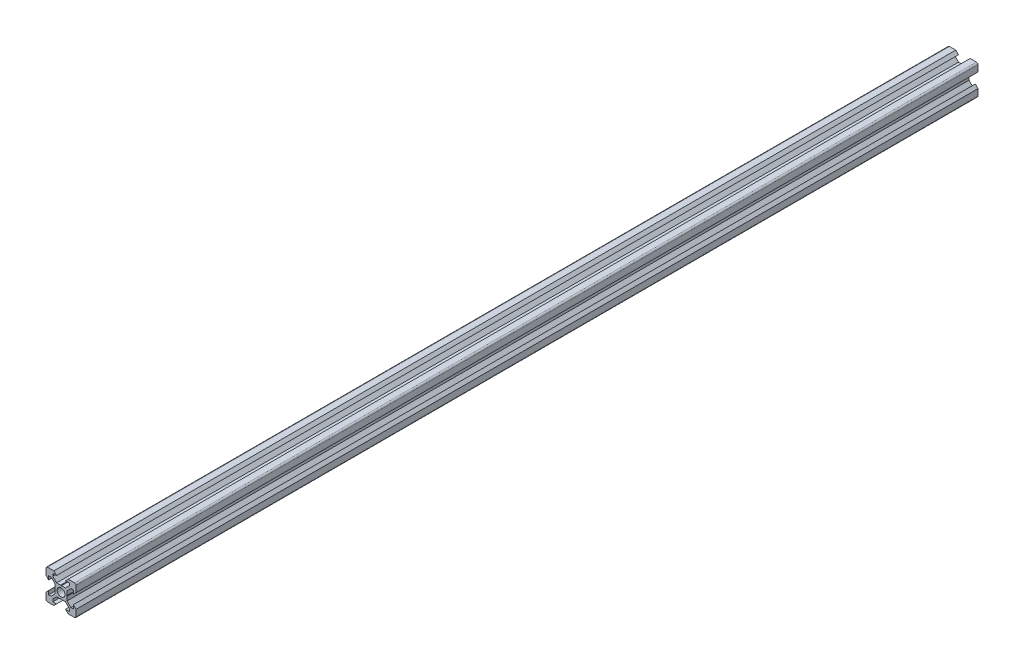
from build123d import *

# Parameters (mm, degrees)
SKETCH1_R           = 2.6
BOSS_EXTRUDE1_DEPTH = 600


with BuildPart() as part:
    # Sketch1 → Boss-Extrude1 (new body)
    with BuildSketch(Plane.XY):
        with BuildLine():
            Line((10.336788111, -8.113366567), (10.336788111, -3.913366567))
            Line((10.336788111, -3.913366567), (8.536788111, -2.113366567))
            Line((8.536788111, -2.113366567), (8.536788111, -4.613366567))
            Line((8.536788111, -4.613366567), (6.897448282, -4.613366567))
            Line((6.897448282, -4.613366567), (4.336788111, -2.052706395))
            Line((4.336788111, -2.052706395), (4.336788111, 0.586633433))
            Line((4.336788111, 0.586633433), (4.036788111, 0.886633433))
            Line((4.036788111, 0.886633433), (4.336788111, 1.186633433))
            Line((4.336788111, 1.186633433), (4.336788111, 3.825973261))
            Line((4.336788111, 3.825973261), (6.897448282, 6.386633433))
            Line((6.897448282, 6.386633433), (8.536788111, 6.386633433))
            Line((8.536788111, 6.386633433), (8.536788111, 3.886633433))
            Line((8.536788111, 3.886633433), (10.336788111, 5.686633433))
            Line((10.336788111, 5.686633433), (10.336788111, 9.886633433))
            ThreePointArc((10.336788111, 9.886633433), (10.043894892, 10.593740214), (9.336788111, 10.886633433))
            Line((9.336788111, 10.886633433), (5.136788111, 10.886633433))
            Line((5.136788111, 10.886633433), (3.336788111, 9.086633433))
            Line((3.336788111, 9.086633433), (5.836788111, 9.086633433))
            Line((5.836788111, 9.086633433), (5.836788111, 7.447293605))
            Line((5.836788111, 7.447293605), (3.276127939, 4.886633433))
            Line((3.276127939, 4.886633433), (0.636788111, 4.886633433))
            Line((0.636788111, 4.886633433), (0.336788111, 4.586633433))
            Line((0.336788111, 4.586633433), (0.036788111, 4.886633433))
            Line((0.036788111, 4.886633433), (-2.602551718, 4.886633433))
            Line((-2.602551718, 4.886633433), (-5.163211889, 7.447293605))
            Line((-5.163211889, 7.447293605), (-5.163211889, 9.086633433))
            Line((-5.163211889, 9.086633433), (-2.663211889, 9.086633433))
            Line((-2.663211889, 9.086633433), (-4.463211889, 10.886633433))
            Line((-4.463211889, 10.886633433), (-8.663211889, 10.886633433))
            ThreePointArc((-8.663211889, 10.886633433), (-9.370318671, 10.593740214), (-9.663211889, 9.886633433))
            Line((-9.663211889, 9.886633433), (-9.663211889, 5.686633433))
            Line((-9.663211889, 5.686633433), (-7.863211889, 3.886633433))
            Line((-7.863211889, 3.886633433), (-7.863211889, 6.386633433))
            Line((-7.863211889, 6.386633433), (-6.223872061, 6.386633433))
            Line((-6.223872061, 6.386633433), (-3.663211889, 3.825973261))
            Line((-3.663211889, 3.825973261), (-3.663211889, 1.186633433))
            Line((-3.663211889, 1.186633433), (-3.363211889, 0.886633433))
            Line((-3.363211889, 0.886633433), (-3.663211889, 0.586633433))
            Line((-3.663211889, 0.586633433), (-3.663211889, -2.052706395))
            Line((-3.663211889, -2.052706395), (-6.223872061, -4.613366567))
            Line((-6.223872061, -4.613366567), (-7.863211889, -4.613366567))
            Line((-7.863211889, -4.613366567), (-7.863211889, -2.113366567))
            Line((-7.863211889, -2.113366567), (-9.663211889, -3.913366567))
            Line((-9.663211889, -3.913366567), (-9.663211889, -8.113366567))
            ThreePointArc((-9.663211889, -8.113366567), (-9.370318671, -8.820473348), (-8.663211889, -9.113366567))
            Line((-8.663211889, -9.113366567), (-4.463211889, -9.113366567))
            Line((-4.463211889, -9.113366567), (-2.663211889, -7.313366567))
            Line((-2.663211889, -7.313366567), (-5.163211889, -7.313366567))
            Line((-5.163211889, -7.313366567), (-5.163211889, -5.674026739))
            Line((-5.163211889, -5.674026739), (-2.602551718, -3.113366567))
            Line((-2.602551718, -3.113366567), (0.036788111, -3.113366567))
            Line((0.036788111, -3.113366567), (0.336788111, -2.813366567))
            Line((0.336788111, -2.813366567), (0.636788111, -3.113366567))
            Line((0.636788111, -3.113366567), (3.276127939, -3.113366567))
            Line((3.276127939, -3.113366567), (5.836788111, -5.674026739))
            Line((5.836788111, -5.674026739), (5.836788111, -7.313366567))
            Line((5.836788111, -7.313366567), (3.336788111, -7.313366567))
            Line((3.336788111, -7.313366567), (5.136788111, -9.113366567))
            Line((5.136788111, -9.113366567), (9.336788111, -9.113366567))
            ThreePointArc((9.336788111, -9.113366567), (10.043894892, -8.820473348), (10.336788111, -8.113366567))
        make_face()
        with Locations((0.336788111, 0.886633433)):
            Circle(SKETCH1_R, mode=Mode.SUBTRACT)
    extrude(amount=BOSS_EXTRUDE1_DEPTH)


solid = part.part
